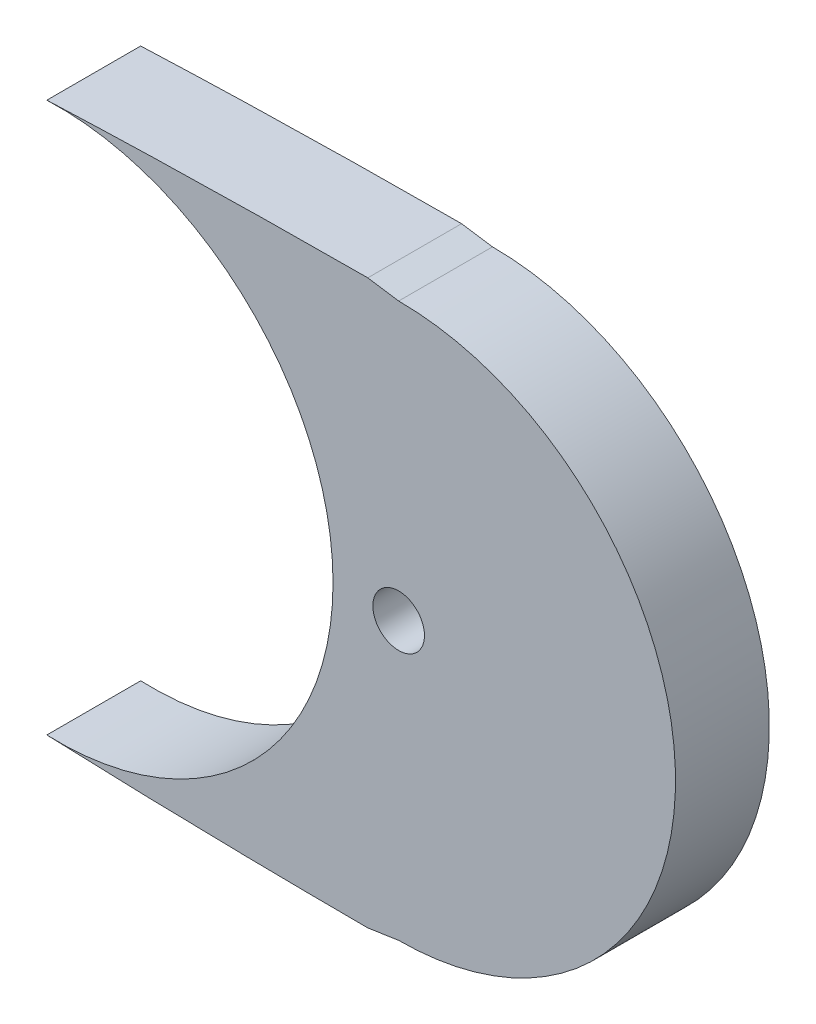
from build123d import *

# Parameters (mm, degrees)
SKETCH2_R           = 1.65
BOSS_EXTRUDE1_DEPTH = 6
CUT_EXTRUDE1_DEPTH  = 110.659974352


with BuildPart() as part:
    # Sketch2 → Boss-Extrude1 (new body)
    with BuildSketch(Plane.XY):
        with BuildLine():
            ThreePointArc((90, -18.005197753), (108.005197753, 0), (90, 18.005197753))
            add(Edge.make_bspline(
                [(90, 18.005197753), (87.300427685, 18.005389985), (81.17457593, 17.968478919), (73.674128402, 17.806885767), (68.874876564, 17.634447138), (67.5, 17.578928476)],
                knots=[0.344744853, 0.344744853, 0.344744853, 0.344744853, 0.357984483, 0.374788114, 0.381536428, 0.381536428, 0.381536428, 0.381536428], degree=3))
            ThreePointArc((67.5, 17.578928476), (85.803106629, 0), (67.5, -17.578928476))
            add(Edge.make_bspline(
                [(67.5, -17.578928476), (68.874876564, -17.634447138), (73.674128402, -17.806885767), (81.17457593, -17.968478919), (87.300427685, -18.005389985), (90, -18.005197753)],
                knots=[0.618463572, 0.618463572, 0.618463572, 0.618463572, 0.625211886, 0.642015517, 0.655255147, 0.655255147, 0.655255147, 0.655255147], degree=3))
        make_face()
        with Locations((90, 0)):
            Circle(SKETCH2_R, mode=Mode.SUBTRACT)
    extrude(amount=BOSS_EXTRUDE1_DEPTH)

    # Sketch3 → Cut-Extrude1 (cut, through all)
    with BuildSketch(Plane.XY.offset(6)):
        with BuildLine():
            Line((88.025921382, 18.002375731), (90, 17.705197753))
            ThreePointArc((90, 17.705197753), (107.705197753, 0), (90, -17.705197753))
            Line((90, -17.705197753), (88.025921382, -18.002375731))
            add(Edge.make_bspline(
                [(88.025921382, -18.002375731), (88.683945552, -18.004313587), (89.341972833, -18.00524461), (90, -18.005197753)],
                knots=[0.652027956, 0.652027956, 0.652027956, 0.652027956, 0.655255147, 0.655255147, 0.655255147, 0.655255147], degree=3))
            ThreePointArc((90, -18.005197753), (108.005197753, 0), (90, 18.005197753))
            add(Edge.make_bspline(
                [(90, 18.005197753), (89.341972833, 18.00524461), (88.683945552, 18.004313587), (88.025921382, 18.002375731)],
                knots=[0.344744853, 0.344744853, 0.344744853, 0.344744853, 0.347972044, 0.347972044, 0.347972044, 0.347972044], degree=3))
        make_face()
    extrude(amount=-CUT_EXTRUDE1_DEPTH, mode=Mode.SUBTRACT)


solid = part.part
